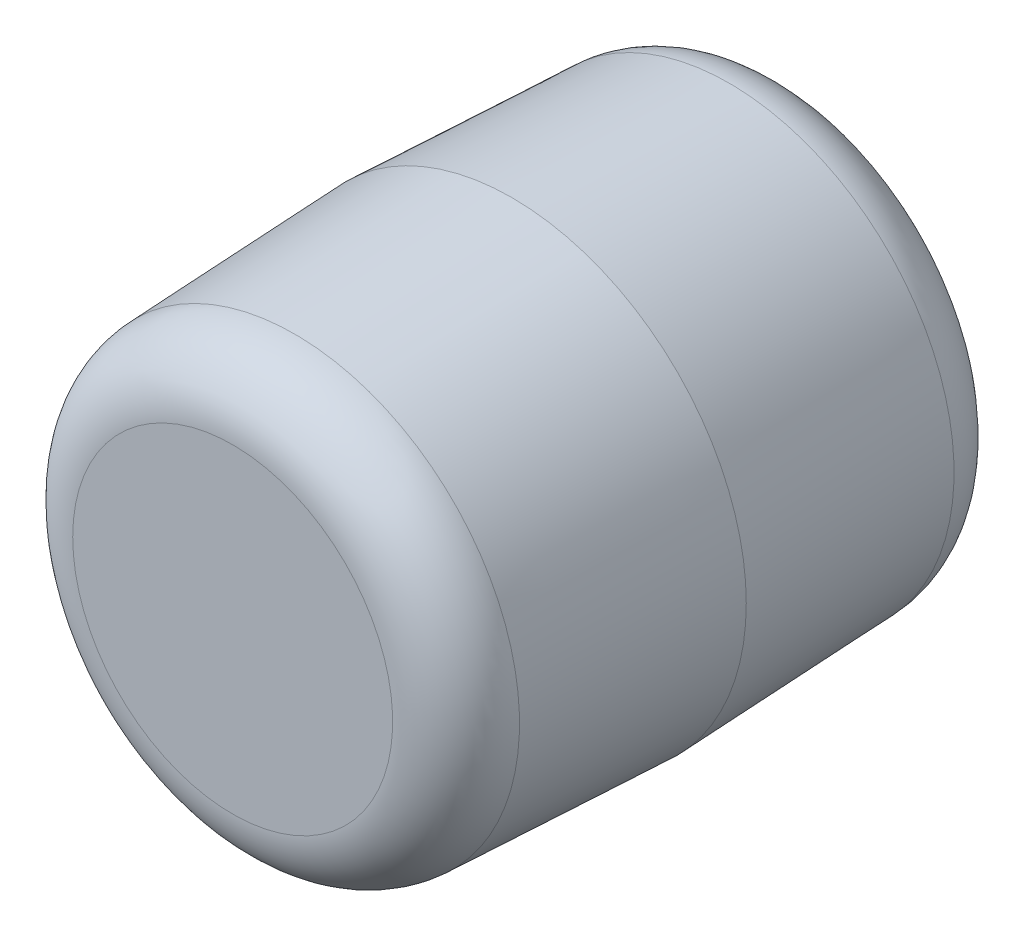
from build123d import *


with BuildPart() as part:
    # Sketch1 → Revolve2 (revolve)
    with BuildSketch(Plane(origin=(0, 0, 0), x_dir=(1, 0, 0), z_dir=(0, 1, 0)), mode=Mode.PRIVATE) as revolve2_sk:
        with BuildLine():
            Line((0, -193.75), (110.96256391, -193.75))
            ThreePointArc((110.96256391, -193.75), (142.08065142, -181.256378293), (155.919733881, -150.712872431))
            Line((155.919733881, -150.712872431), (162.5, 0))
            Line((162.5, 0), (155.919733881, 150.712872431))
            ThreePointArc((155.919733881, 150.712872431), (142.08065142, 181.256378293), (110.96256391, 193.75))
            Line((110.96256391, 193.75), (37, 193.75))
            ThreePointArc((37, 193.75), (28.514718626, 197.264718626), (25, 205.75))
            Line((25, 205.75), (25, 213.75))
            Line((25, 213.75), (21, 213.75))
            Line((21, 213.75), (21, 205.75))
            ThreePointArc((21, 205.75), (25.686291501, 194.436291501), (37, 189.75))
            Line((37, 189.75), (110.96256391, 189.75))
            ThreePointArc((110.96256391, 189.75), (139.314599197, 178.366922444), (151.923540995, 150.538394882))
            Line((151.923540995, 150.538394882), (158.496189259, 0))
            Line((158.496189259, 0), (151.923540995, -150.538394882))
            ThreePointArc((151.923540995, -150.538394882), (139.314599197, -178.366922444), (110.96256391, -189.75))
            Line((110.96256391, -189.75), (0, -189.75))
            Line((0, -189.75), (0, -193.75))
        make_face()
    revolve(revolve2_sk.sketch.rotate(Axis((0, 0, -288.058740368), (0, 0, 1)), 180), axis=Axis((0, 0, -288.058740368), (0, 0, 1)))


solid = part.part
